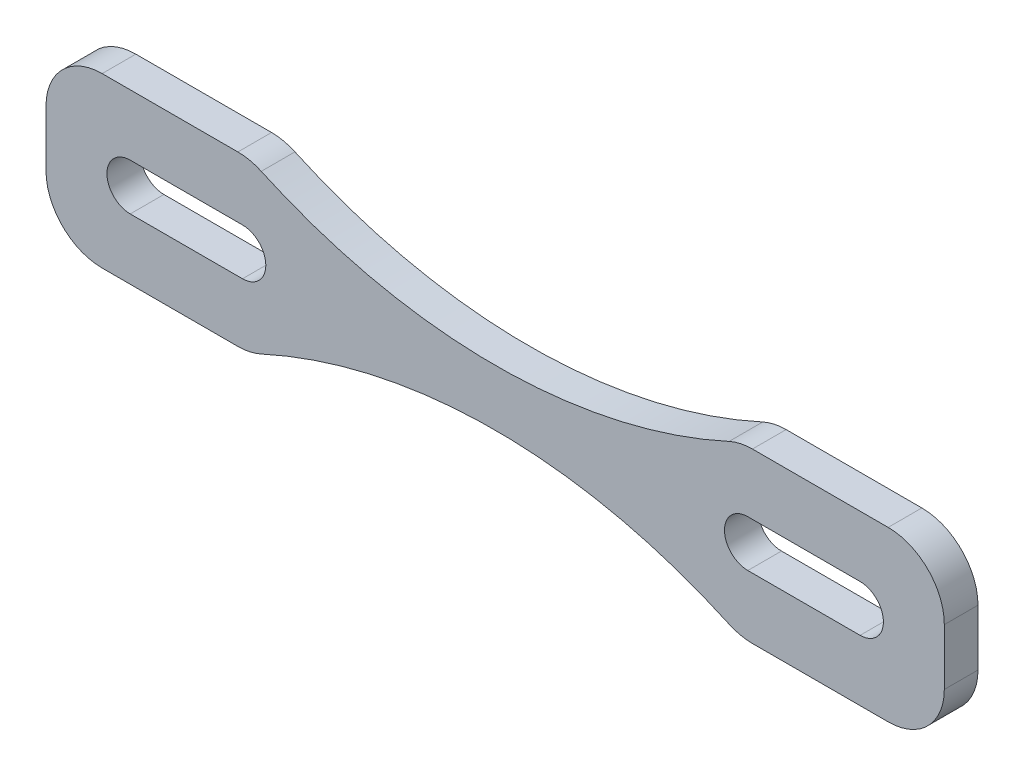
from build123d import *

# Parameters (mm, degrees)
BOSS_EXTRUDE1_DEPTH = 6
FILLET1_R           = 10


with BuildPart() as part:
    # Sketch1 → Boss-Extrude1 (new body)
    with BuildSketch(Plane.XY):
        with BuildLine():
            Line((-80, -15), (-43.588989435, -15))
            ThreePointArc((-43.588989435, -15), (0, -5), (43.588989435, -15))
            Line((43.588989435, -15), (80, -15))
            Line((80, -15), (80, 15))
            Line((80, 15), (43.588989435, 15))
            ThreePointArc((43.588989435, 15), (0, 5), (-43.588989435, 15))
            Line((-43.588989435, 15), (-80, 15))
            Line((-80, 15), (-80, -15))
        make_face()
        with BuildLine():
            Line((-65, 4.15), (-45, 4.15))
            ThreePointArc((-45, 4.15), (-40.85, 0), (-45, -4.15))
            Line((-45, -4.15), (-65, -4.15))
            ThreePointArc((-65, -4.15), (-69.15, 0), (-65, 4.15))
        make_face(mode=Mode.SUBTRACT)
        with BuildLine():
            Line((65, 4.15), (45, 4.15))
            ThreePointArc((45, 4.15), (40.85, 0), (45, -4.15))
            Line((45, -4.15), (65, -4.15))
            ThreePointArc((65, -4.15), (69.15, 0), (65, 4.15))
        make_face(mode=Mode.SUBTRACT)
    extrude(amount=BOSS_EXTRUDE1_DEPTH)

    # Fillet1
    fillet1_edges = [part.edges().sort_by_distance(p)[0] for p in [
        (80, 15, 3),
        (80, -15, 3),
        (43.588989435, -15, 3),
        (-43.588989435, -15, 3),
        (-80, -15, 3),
        (-80, 15, 3),
        (-43.588989435, 15, 3),
        (43.588989435, 15, 3),
    ]]
    fillet(fillet1_edges, radius=FILLET1_R)


solid = part.part
